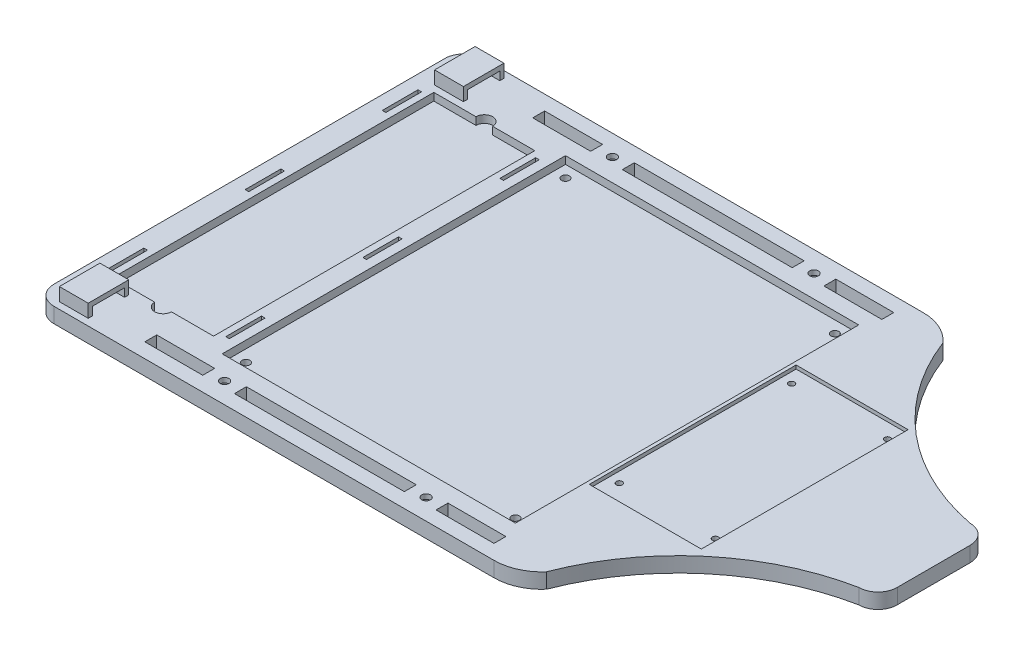
from build123d import *

# Parameters (mm, degrees)
SALIENTE_EXTRUIR1_DEPTH = 6.35
CROQUIS2_R              = 1.825
CROQUIS2_W              = 63.849825594
CROQUIS2_H              = 5
CROQUIS2_W_2            = 24.299825594
CORTAR_EXTRUIR1_DEPTH   = 220.409920137
CORTAR_EXTRUIR2_DEPTH   = 3.175
CROQUIS4_W              = 45
CROQUIS4_H              = 80.85
CORTAR_EXTRUIR3_DEPTH   = 1.5
CROQUIS5_R              = 1.25
CORTAR_EXTRUIR4_DEPTH   = 220.371632292
CROQUIS7_W              = 44.995929737
CROQUIS7_H              = 3.9
CORTAR_EXTRUIR5_DEPTH   = 1.5
CROQUIS8_W              = 1.5
CROQUIS8_H              = 15
CORTAR_EXTRUIR6_DEPTH   = 220.409920137
CROQUIS9_W              = 123
CROQUIS9_H              = 144
CORTAR_EXTRUIR7_DEPTH   = 3.175
CROQUIS10_R             = 2.8
CORTAR_EXTRUIR8_DEPTH   = 4.35
CROQUIS11_R             = 1.65
CORTAR_EXTRUIR9_DEPTH   = 220.34099293
CROQUIS13_W             = 12.1
CROQUIS13_H             = 17
SALIENTE_EXTRUIR2_DEPTH = 5.5
CROQUIS14_W             = 13.5
CROQUIS14_H             = 3.5
CORTAR_EXTRUIR10_DEPTH  = 12.1
CROQUIS15_W             = 13.5
CROQUIS15_H             = 3.5
CORTAR_EXTRUIR11_DEPTH  = 12.1
CORTAR_EXTRUIR12_DEPTH  = 220.409920137
CORTAR_EXTRUIR15_DEPTH  = 1.5
CROQUIS19_W             = 7.395174406
CROQUIS19_H             = 5
CORTAR_EXTRUIR16_DEPTH  = 220.409920137


with BuildPart() as part:
    # Croquis1 → Saliente-Extruir1 (new body)
    with BuildSketch(Plane(origin=(0, 0, 0), x_dir=(1, 0, 0), z_dir=(0, 1, 0))):
        with BuildLine():
            Line((0, 0), (200, 0))
            Line((200, 0), (200, 15.2))
            ThreePointArc((200, 15.2), (197.701163079, 20.938172036), (191.9990235, 23.3249845))
            ThreePointArc((191.9990235, 23.3249845), (148.666739026, 44.032184001), (120.7781513, 83.1307986))
            ThreePointArc((120.7781513, 83.1307986), (113.982057966, 88.196272982), (105.7, 90))
            Line((105.7, 90), (0, 90))
            Line((0, 90), (-79, 90))
            ThreePointArc((-79, 90), (-84.638146896, 87.675499941), (-86.999825594, 82.052824894))
            Line((-86.999825594, 82.052824894), (-86.999825594, 41.494023494))
            ThreePointArc((-86.999825594, 41.494023494), (-92.052704294, 29.329564667), (-102.353503833, 21.119864881))
            ThreePointArc((-102.353503833, 21.119864881), (-108.040391417, 18.79326931), (-110.4, 13.12))
            Line((-110.4, 13.12), (-110.4, 0))
            Line((-110.4, 0), (0, 0))
        make_face()
    extrude(amount=SALIENTE_EXTRUIR1_DEPTH)

    # Simetría2: part across plane


with BuildPart() as part_1:
    add(part.part)
    add(part.part.mirror(Plane(origin=(0, 6.35, 0), x_dir=(1, 0, 0), z_dir=(0, 0, -1))))

    # Croquis2 → Cortar-Extruir1 (cut, through all)
    with BuildSketch(Plane(origin=(0, 6.35, 0), x_dir=(1, 0, 0), z_dir=(0, 1, 0))):
        with Locations(Location((68.5, 81.35, 0), (0, 0, 270))):
            Circle(CROQUIS2_R)
        with Locations(Location((-16.05, 81.35, 0), (0, 0, 270))):
            Circle(CROQUIS2_R)
        with Locations(Location((68.5, -81.35, 0), (0, 0, 90))):
            Circle(CROQUIS2_R)
        with Locations(Location((-16.05, -81.35, 0), (0, 0, 90))):
            Circle(CROQUIS2_R)
        with Locations((29.925087203, -81.35)):
            Rectangle(CROQUIS2_W, CROQUIS2_H)
        with Locations((-34.849912797, -81.35)):
            Rectangle(CROQUIS2_W_2, CROQUIS2_H)
        with Locations((87.299912797, -81.35)):
            Rectangle(CROQUIS2_W_2, CROQUIS2_H)
        with Locations((-34.849912797, 81.35)):
            Rectangle(CROQUIS2_W_2, CROQUIS2_H)
        with Locations((29.925087203, 81.35)):
            Rectangle(CROQUIS2_W, CROQUIS2_H)
        with Locations((87.299912797, 81.35)):
            Rectangle(CROQUIS2_W_2, CROQUIS2_H)
    extrude(amount=-CORTAR_EXTRUIR1_DEPTH, mode=Mode.SUBTRACT)

    # Croquis3 → Cortar-Extruir2 (cut)
    with BuildSketch(Plane(origin=(0, 6.35, 0), x_dir=(1, 0, 0), z_dir=(0, 1, 0))):
        with BuildLine():
            Line((-76.999825594, 67.375), (-59.324825594, 67.375))
            ThreePointArc((-59.324825594, 67.375), (-55.824825594, 70.875), (-52.324825594, 67.375))
            Line((-52.324825594, 67.375), (-34.649825594, 67.375))
            Line((-34.649825594, 67.375), (-34.649825594, -67.375))
            Line((-34.649825594, -67.375), (-52.324825594, -67.375))
            ThreePointArc((-52.324825594, -67.375), (-55.824825594, -70.875), (-59.324825594, -67.375))
            Line((-59.324825594, -67.375), (-76.999825594, -67.375))
            Line((-76.999825594, -67.375), (-76.999825594, 67.375))
        make_face()
    extrude(amount=-CORTAR_EXTRUIR2_DEPTH, mode=Mode.SUBTRACT)

    # Croquis4 → Cortar-Extruir3 (cut)
    with BuildSketch(Plane(origin=(0, 6.35, 0), x_dir=(1, 0, 0), z_dir=(0, 1, 0))):
        with Locations((122.5, 0)):
            Rectangle(CROQUIS4_W, CROQUIS4_H)
    extrude(amount=-CORTAR_EXTRUIR3_DEPTH, mode=Mode.SUBTRACT)

    # Croquis5 → Cortar-Extruir4 (cut, through all)
    with BuildSketch(Plane(origin=(0, 4.85, 0), x_dir=(1, 0, 0), z_dir=(0, 1, 0))):
        with Locations(Location((142.65, -34.175, 0), (0, 0, 270))):
            Circle(CROQUIS5_R)
        with Locations(Location((102.35, -34.175, 0), (0, 0, 90))):
            Circle(CROQUIS5_R)
        with Locations(Location((142.65, 38.075, 0), (0, 0, 270))):
            Circle(CROQUIS5_R)
        with Locations(Location((102.35, 38.075, 0), (0, 0, 90))):
            Circle(CROQUIS5_R)
    extrude(amount=-CORTAR_EXTRUIR4_DEPTH, mode=Mode.SUBTRACT)

    # Croquis7 → Cortar-Extruir5 (cut)
    with BuildSketch(Plane(origin=(0, 6.35, 0), x_dir=(1, 0, 0), z_dir=(0, 1, 0))):
        with Locations((122.497964869, 42.375)):
            Rectangle(CROQUIS7_W, CROQUIS7_H)
    extrude(amount=-CORTAR_EXTRUIR5_DEPTH, mode=Mode.SUBTRACT)

    # Croquis8 → Cortar-Extruir6 (cut, through all)
    with BuildSketch(Plane(origin=(0, 6.35, 0), x_dir=(1, 0, 0), z_dir=(0, 1, 0))):
        with Locations((-80.499825594, -57.5)):
            Rectangle(CROQUIS8_W, CROQUIS8_H)
        with Locations((-80.499825594, 57.5)):
            Rectangle(CROQUIS8_W, CROQUIS8_H)
        with Locations((-31.149825594, -57.5)):
            Rectangle(CROQUIS8_W, CROQUIS8_H)
        with Locations((-80.499825594, 0)):
            Rectangle(CROQUIS8_W, CROQUIS8_H)
        with Locations((-31.149825594, 0)):
            Rectangle(CROQUIS8_W, CROQUIS8_H)
        with Locations((-31.149825594, 57.5)):
            Rectangle(CROQUIS8_W, CROQUIS8_H)
    extrude(amount=-CORTAR_EXTRUIR6_DEPTH, mode=Mode.SUBTRACT)

    # Croquis9 → Cortar-Extruir7 (cut)
    with BuildSketch(Plane(origin=(0, 6.35, 0), x_dir=(1, 0, 0), z_dir=(0, 1, 0))):
        with Locations((35.100174406, 0)):
            Rectangle(CROQUIS9_W, CROQUIS9_H)
    extrude(amount=-CORTAR_EXTRUIR7_DEPTH, mode=Mode.SUBTRACT)

    # Croquis10 → Cortar-Extruir8 (cut)
    with BuildSketch(Plane.XZ):
        with Locations(Location((-16.05, 81.35, 0), (0, 0, 270))):
            Circle(CROQUIS10_R)
        with Locations(Location((-16.05, -81.35, 0), (0, 0, 90))):
            Circle(CROQUIS10_R)
        with Locations(Location((68.5, -81.35, 0), (0, 0, 270))):
            Circle(CROQUIS10_R)
        with Locations(Location((68.5, 81.35, 0), (0, 0, 90))):
            Circle(CROQUIS10_R)
    extrude(amount=-CORTAR_EXTRUIR8_DEPTH, mode=Mode.SUBTRACT)

    # Croquis11 → Cortar-Extruir9 (cut, through all)
    with BuildSketch(Plane(origin=(0, 3.175, 0), x_dir=(1, 0, 0), z_dir=(0, 1, 0))):
        with Locations(Location((-21.399825594, 67, 0), (0, 0, 270))):
            Circle(CROQUIS11_R)
        with Locations(Location((91.600174406, 67, 0), (0, 0, 90))):
            Circle(CROQUIS11_R)
        with Locations(Location((91.600174406, -67, 0), (0, 0, 270))):
            Circle(CROQUIS11_R)
        with Locations(Location((-21.399825594, -67, 0), (0, 0, 90))):
            Circle(CROQUIS11_R)
    extrude(amount=-CORTAR_EXTRUIR9_DEPTH, mode=Mode.SUBTRACT)

    # Croquis13 → Saliente-Extruir2 (add)
    with BuildSketch(Plane(origin=(0, 6.35, 0), x_dir=(1, 0, 0), z_dir=(0, 1, 0))):
        with Locations((-73.449825594, 78.6875)):
            Rectangle(CROQUIS13_W, CROQUIS13_H)
        with Locations((-73.449825594, -78.6875)):
            Rectangle(CROQUIS13_W, CROQUIS13_H)
    extrude(amount=SALIENTE_EXTRUIR2_DEPTH)

    # Croquis14 → Cortar-Extruir10 (cut)
    with BuildSketch(Plane.ZY.offset(79.499825594)):
        with Locations((78.6875, 8.1)):
            Rectangle(CROQUIS14_W, CROQUIS14_H)
    extrude(amount=-CORTAR_EXTRUIR10_DEPTH, mode=Mode.SUBTRACT)

    # Croquis15 → Cortar-Extruir11 (cut)
    with BuildSketch(Plane.ZY.offset(79.499825594)):
        with Locations((-78.6875, 8.1)):
            Rectangle(CROQUIS15_W, CROQUIS15_H)
    extrude(amount=-CORTAR_EXTRUIR11_DEPTH, mode=Mode.SUBTRACT)

    # Croquis16 → Cortar-Extruir12 (cut, through all)
    with BuildSketch(Plane(origin=(0, 6.35, 0), x_dir=(1, 0, 0), z_dir=(0, 1, 0))):
        Polygon((-86.999825594, 41.494023494), (-110.4, 41.494023494), (-110.4, 13.12), (-110.4, -13.12), (-110.4, -41.494023494), (-86.999825594, -41.494023494), align=None)
    extrude(amount=-CORTAR_EXTRUIR12_DEPTH, mode=Mode.SUBTRACT)

    # Croquis18 → Cortar-Extruir15 (cut)
    with BuildSketch(Plane(origin=(0, 6.35, 0), x_dir=(1, 0, 0), z_dir=(0, 1, 0))):
        Polygon((100, 44.325), (98, 44.325), (98, -42.425), (144.995929737, -42.425), (145, -40.425), (100, -40.425), align=None)
    extrude(amount=-CORTAR_EXTRUIR15_DEPTH, mode=Mode.SUBTRACT)

    # Croquis19 → Cortar-Extruir16 (cut, through all)
    with BuildSketch(Plane(origin=(0, 6.35, 0), x_dir=(1, 0, 0), z_dir=(0, 1, 0))):
        with Locations((-5.697412797, 81.35)):
            Rectangle(CROQUIS19_W, CROQUIS19_H)
        with Locations((-5.697412797, -81.35)):
            Rectangle(CROQUIS19_W, CROQUIS19_H)
    extrude(amount=-CORTAR_EXTRUIR16_DEPTH, mode=Mode.SUBTRACT)


solid = part_1.part
